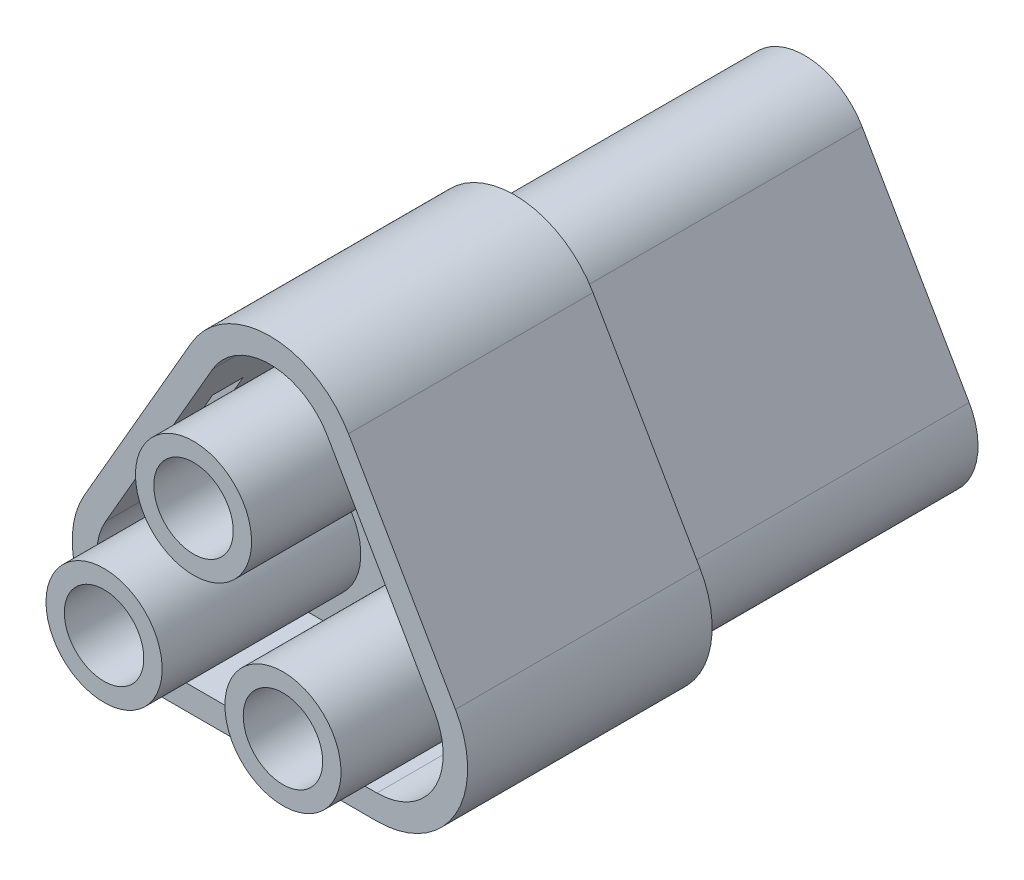
from build123d import *

# Parameters (mm, degrees)
SKETCH_1_R          = 1.9
EXTRUDE_1_DEPTH     = 9.5
EXTRUDE_2_DEPTH     = 4
EXTRUDE_3_DEPTH     = 4
SKETCH_4_R          = 1.9
SKETCH_4_R_2        = 1.75
EXTRUDE_4_DEPTH     = 9.5
EXTRUDE_4_2_DEPTH   = 9.5
EXTRUDE_4_3_DEPTH   = 9.5
SKETCH_5_R          = 1.9
SKETCH_5_R_2        = 1.3
EXTRUDE_5_DEPTH     = 6.5
EXTRUDE_5_2_DEPTH   = 6.5
EXTRUDE_5_3_DEPTH   = 6.5
SKETCH_6_W          = 1
SKETCH_6_H          = 3
CUT_EXTRUDE_1_DEPTH = 1


with BuildPart() as part:
    # Эскиз1 → Бобышка-Вытянуть1 (new body)
    with BuildSketch(Plane.XY):
        with BuildLine():
            Line((-1.8783321, 10.115544457), (-3.2283321, 7.777275866))
            Line((-3.2283321, 7.777275866), (-2.881921938, 7.577275866))
            ThreePointArc((-2.881921938, 7.577275866), (-2.648959025, 7.273672687), (-2.698909236, 6.894263165))
            Line((-2.698909236, 6.894263165), (-2.998909236, 6.374647922))
            ThreePointArc((-2.998909236, 6.374647922), (-3.302512416, 6.141685009), (-3.681921938, 6.19163522))
            Line((-3.681921938, 6.19163522), (-4.0283321, 6.39163522))
            Line((-4.0283321, 6.39163522), (-5.3783321, 4.05336663))
            ThreePointArc((-5.3783321, 4.05336663), (-5.3783321, 1.884455543), (-3.5, 0.8))
            Line((-3.5, 0.8), (3.5, 0.8))
            ThreePointArc((3.5, 0.8), (5.3783321, 1.884455543), (5.3783321, 4.05336663))
            Line((5.3783321, 4.05336663), (1.8783321, 10.115544457))
            ThreePointArc((1.8783321, 10.115544457), (0, 11.2), (-1.8783321, 10.115544457))
        make_face()
        with Locations((-2.92653718, 3.3)):
            Circle(SKETCH_1_R, mode=Mode.SUBTRACT)
        with Locations((0, 8.368911087)):
            Circle(SKETCH_1_R, mode=Mode.SUBTRACT)
        with Locations((2.92653718, 3.3)):
            Circle(SKETCH_1_R, mode=Mode.SUBTRACT)
    extrude(amount=EXTRUDE_1_DEPTH)

    # Эскиз2 → Бобышка-Вытянуть2 (add)
    with BuildSketch(Plane.XY.offset(9.5)):
        with BuildLine():
            Line((6.071152423, 4.45336663), (2.571152423, 10.515544457))
            ThreePointArc((2.571152423, 10.515544457), (0, 12), (-2.571152423, 10.515544457))
            Line((-2.571152423, 10.515544457), (-6.071152423, 4.45336663))
            ThreePointArc((-6.071152423, 4.45336663), (-6.071152423, 1.484455543), (-3.5, 0))
            Line((-3.5, 0), (3.5, 0))
            ThreePointArc((3.5, 0), (6.071152423, 1.484455543), (6.071152423, 4.45336663))
        make_face()
    extrude(amount=EXTRUDE_2_DEPTH)

    # Эскиз3 → Бобышка-Вытянуть3 (add)
    with BuildSketch(Plane.XY.offset(13.5)):
        with BuildLine():
            Line((-3.5, 0), (3.5, 0))
            ThreePointArc((3.5, 0), (6.071152423, 1.484455543), (6.071152423, 4.45336663))
            Line((6.071152423, 4.45336663), (2.571152423, 10.515544457))
            ThreePointArc((2.571152423, 10.515544457), (0, 12), (-2.571152423, 10.515544457))
            Line((-2.571152423, 10.515544457), (-6.071152423, 4.45336663))
            ThreePointArc((-6.071152423, 4.45336663), (-6.071152423, 1.484455543), (-3.5, 0))
        make_face()
        with BuildLine():
            ThreePointArc((3.5, 0.8), (5.3783321, 1.884455543), (5.3783321, 4.05336663))
            Line((5.3783321, 4.05336663), (1.8783321, 10.115544457))
            ThreePointArc((1.8783321, 10.115544457), (0, 11.2), (-1.8783321, 10.115544457))
            Line((-1.8783321, 10.115544457), (-5.3783321, 4.05336663))
            ThreePointArc((-5.3783321, 4.05336663), (-5.3783321, 1.884455543), (-3.5, 0.8))
            Line((-3.5, 0.8), (3.5, 0.8))
        make_face(mode=Mode.SUBTRACT)
    extrude(amount=EXTRUDE_3_DEPTH)

    # Эскиз6 → Вырез-Вытянуть1 (cut)
    with BuildSketch(Plane(origin=(-6.481728634, 3.742227772, 0), x_dir=(0, 0, 1), z_dir=(-0.8660254037844387, 0.49999999999999994, 0))):
        with Locations((16, 4.321152423)):
            Rectangle(SKETCH_6_W, SKETCH_6_H)
    extrude(amount=-CUT_EXTRUDE_1_DEPTH, mode=Mode.SUBTRACT)


with BuildPart() as body_2:
    # Эскиз4 → Бобышка-Вытянуть4 (new body)
    with BuildSketch(Plane(origin=(0, 0, 9.5), x_dir=(-1, 0, 0), z_dir=(0, 0, -1))):
        with Locations(Location((0, 8.368911087, 0), (0, 0, 180))):
            Circle(SKETCH_4_R)
        with Locations(Location((0, 8.368911087, 0), (0, 0, 180))):
            Circle(SKETCH_4_R_2, mode=Mode.SUBTRACT)
    extrude(amount=EXTRUDE_4_DEPTH)


with BuildPart() as body_3:
    # Эскиз4 → Extrude 4 2 (new body)
    with BuildSketch(Plane(origin=(0, 0, 9.5), x_dir=(-1, 0, 0), z_dir=(0, 0, -1))):
        with Locations(Location((-2.92653718, 3.3, 0), (0, 0, 180))):
            Circle(SKETCH_4_R)
        with Locations(Location((-2.92653718, 3.3, 0), (0, 0, 180))):
            Circle(SKETCH_4_R_2, mode=Mode.SUBTRACT)
    extrude(amount=EXTRUDE_4_2_DEPTH)


with BuildPart() as body_4:
    # Эскиз4 → Extrude 4 3 (new body)
    with BuildSketch(Plane(origin=(0, 0, 9.5), x_dir=(-1, 0, 0), z_dir=(0, 0, -1))):
        with Locations(Location((2.92653718, 3.3, 0), (0, 0, 180))):
            Circle(SKETCH_4_R)
        with Locations(Location((2.92653718, 3.3, 0), (0, 0, 180))):
            Circle(SKETCH_4_R_2, mode=Mode.SUBTRACT)
    extrude(amount=EXTRUDE_4_3_DEPTH)


with BuildPart() as body_5:
    # Эскиз5 → Бобышка-Вытянуть5 (new body)
    with BuildSketch(Plane.XY.offset(13.5)):
        with Locations(Location((0, 8.368911087, 0), (0, 0, 180))):
            Circle(SKETCH_5_R)
        with Locations(Location((0, 8.368911087, 0), (0, 0, 180))):
            Circle(SKETCH_5_R_2, mode=Mode.SUBTRACT)
    extrude(amount=EXTRUDE_5_DEPTH)


with BuildPart() as body_6:
    # Эскиз5 → Extrude 5 2 (new body)
    with BuildSketch(Plane.XY.offset(13.5)):
        with Locations(Location((2.92653718, 3.3, 0), (0, 0, 180))):
            Circle(SKETCH_5_R)
        with Locations(Location((2.92653718, 3.3, 0), (0, 0, 180))):
            Circle(SKETCH_5_R_2, mode=Mode.SUBTRACT)
    extrude(amount=EXTRUDE_5_2_DEPTH)


with BuildPart() as body_7:
    # Эскиз5 → Extrude 5 3 (new body)
    with BuildSketch(Plane.XY.offset(13.5)):
        with Locations(Location((-2.92653718, 3.3, 0), (0, 0, 180))):
            Circle(SKETCH_5_R)
        with Locations(Location((-2.92653718, 3.3, 0), (0, 0, 180))):
            Circle(SKETCH_5_R_2, mode=Mode.SUBTRACT)
    extrude(amount=EXTRUDE_5_3_DEPTH)


solid = Compound([part.part, body_2.part, body_3.part, body_4.part, body_5.part, body_6.part, body_7.part])
